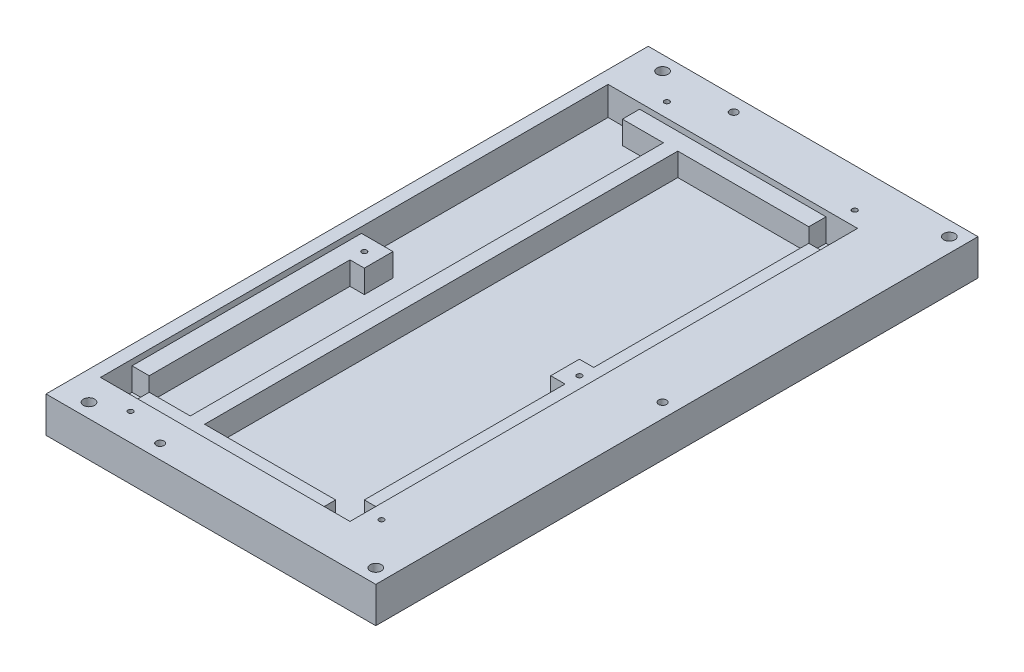
from build123d import *

# Parameters (mm, degrees)
SKETCH1_W                 = 146.05
SKETCH1_H                 = 266.7
BOSS_EXTRUDE1_DEPTH       = 15.875
SKETCH2_W                 = 110.49
SKETCH2_H                 = 224.79
CUT_EXTRUDE1_DEPTH        = 2.54
CUT_EXTRUDE2_DEPTH        = 10.16
F_4_40_TAPPED_HOLE1_D     = 2.2606
F_4_40_TAPPED_HOLE1_DEPTH = 10.16
F_4_40_TAPPED_HOLE1_TIP   = 0.679152758
F_8_CLEARANCE_HOLE1_D     = 4.9149
F_8_32_TAPPED_HOLE1_D     = 3.4544
F_8_32_TAPPED_HOLE1_DEPTH = 12.7
F_8_32_TAPPED_HOLE1_TIP   = 1.037806461
F_4_40_TAPPED_HOLE2_D     = 2.2606
F_4_40_TAPPED_HOLE2_DEPTH = 10.16
F_4_40_TAPPED_HOLE2_TIP   = 0.679152758


with BuildPart() as part:
    # Sketch1 → Boss-Extrude1 (new body)
    with BuildSketch(Plane(origin=(0, 0, 0), x_dir=(1, 0, 0), z_dir=(0, 1, 0))):
        with Locations((73.025, 133.35)):
            Rectangle(SKETCH1_W, SKETCH1_H)
    extrude(amount=BOSS_EXTRUDE1_DEPTH)

    # Sketch2 → Cut-Extrude1 (cut)
    with BuildSketch(Plane(origin=(0, 15.875, 0), x_dir=(1, 0, 0), z_dir=(0, 1, 0))):
        with Locations((60.96, 130.81)):
            Rectangle(SKETCH2_W, SKETCH2_H)
    extrude(amount=-CUT_EXTRUDE1_DEPTH, mode=Mode.SUBTRACT)

    # Sketch3 → Cut-Extrude2 (cut)
    with BuildSketch(Plane(origin=(0, 13.335, 0), x_dir=(1, 0, 0), z_dir=(0, 1, 0))):
        Polygon((19.685, 26.035), (19.685, 18.415), (5.715, 18.415), (5.715, 32.385), (13.335, 32.385), (13.335, 121.285), (19.685, 121.285), (19.685, 133.985), (5.715, 133.985), (5.715, 243.205), (19.685, 243.205), (19.685, 235.585), (37.8587, 235.585), (37.8587, 26.035), align=None)
        Polygon((44.2087, 26.035), (102.235, 26.035), (102.235, 18.415), (116.205, 18.415), (116.205, 32.385), (108.585, 32.385), (108.585, 121.285), (102.235, 121.285), (102.235, 133.985), (108.585, 133.985), (108.585, 229.235), (116.205, 229.235), (116.205, 243.205), (102.235, 243.205), (102.235, 235.585), (44.2087, 235.585), align=None)
    extrude(amount=-CUT_EXTRUDE2_DEPTH, mode=Mode.SUBTRACT)

    # #4-40 Tapped Hole1
    with Locations(Plane(origin=(0, 13.335, 0), x_dir=(1, 0, 0), z_dir=(0, 1, 0))):
        with Locations((108.585, 127.635), (13.335, 127.635)):
            Hole(F_4_40_TAPPED_HOLE1_D / 2, depth=F_4_40_TAPPED_HOLE1_DEPTH)
            with Locations((0, 0, -(F_4_40_TAPPED_HOLE1_DEPTH + F_4_40_TAPPED_HOLE1_TIP / 2))):  # 118° drill point
                Cone(0, F_4_40_TAPPED_HOLE1_D / 2, F_4_40_TAPPED_HOLE1_TIP, mode=Mode.SUBTRACT)

    # #8 Clearance Hole1 (through all)
    with Locations(Plane(origin=(0, 15.875, 0), x_dir=(1, 0, 0), z_dir=(0, 1, 0))):
        with Locations((12.7, 6.35), (139.7, 6.35), (139.7, 260.35), (12.7, 260.35)):
            Hole(F_8_CLEARANCE_HOLE1_D / 2)

    # #8-32 Tapped Hole1
    with Locations(Plane(origin=(0, 15.875, 0), x_dir=(1, 0, 0), z_dir=(0, 1, 0))):
        with Locations((44.2087, 6.35), (44.2087, 260.35), (139.7, 133.35)):
            Hole(F_8_32_TAPPED_HOLE1_D / 2, depth=F_8_32_TAPPED_HOLE1_DEPTH)
            with Locations((0, 0, -(F_8_32_TAPPED_HOLE1_DEPTH + F_8_32_TAPPED_HOLE1_TIP / 2))):  # 118° drill point
                Cone(0, F_8_32_TAPPED_HOLE1_D / 2, F_8_32_TAPPED_HOLE1_TIP, mode=Mode.SUBTRACT)

    # #4-40 Tapped Hole2
    with Locations(Plane(origin=(0, 15.875, 0), x_dir=(1, 0, 0), z_dir=(0, 1, 0))):
        with Locations((108.585, 249.555), (122.555, 26.035), (25.4, 249.555), (25.4, 12.065)):
            Hole(F_4_40_TAPPED_HOLE2_D / 2, depth=F_4_40_TAPPED_HOLE2_DEPTH)
            with Locations((0, 0, -(F_4_40_TAPPED_HOLE2_DEPTH + F_4_40_TAPPED_HOLE2_TIP / 2))):  # 118° drill point
                Cone(0, F_4_40_TAPPED_HOLE2_D / 2, F_4_40_TAPPED_HOLE2_TIP, mode=Mode.SUBTRACT)


solid = part.part
